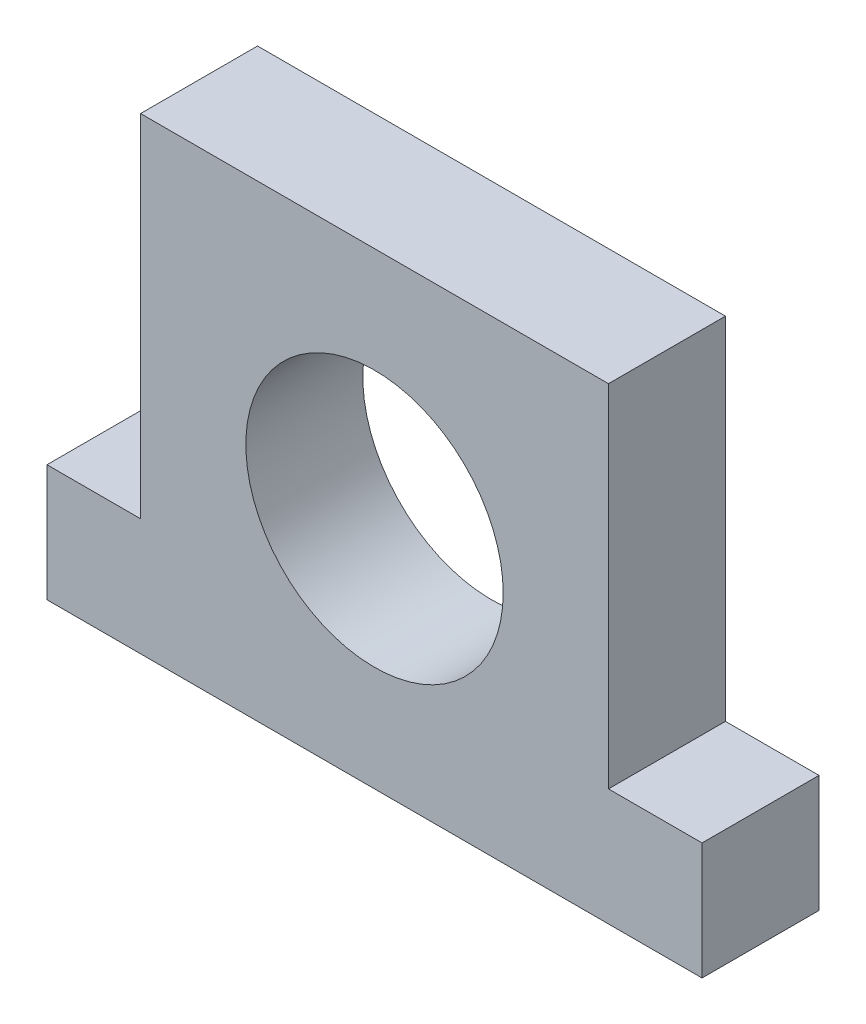
from build123d import *

# Parameters (mm, degrees)
SKETCH1_R           = 11
BOSS_EXTRUDE1_DEPTH = 10


with BuildPart() as part:
    # Sketch1 → Boss-Extrude1 (new body)
    with BuildSketch(Plane.XY):
        Polygon((28, 0), (-28, 0), (-28, 10), (-20, 10), (-20, 40), (20, 40), (20, 10), (28, 10), align=None)
        with Locations((0, 20)):
            Circle(SKETCH1_R, mode=Mode.SUBTRACT)
    extrude(amount=BOSS_EXTRUDE1_DEPTH)


solid = part.part
